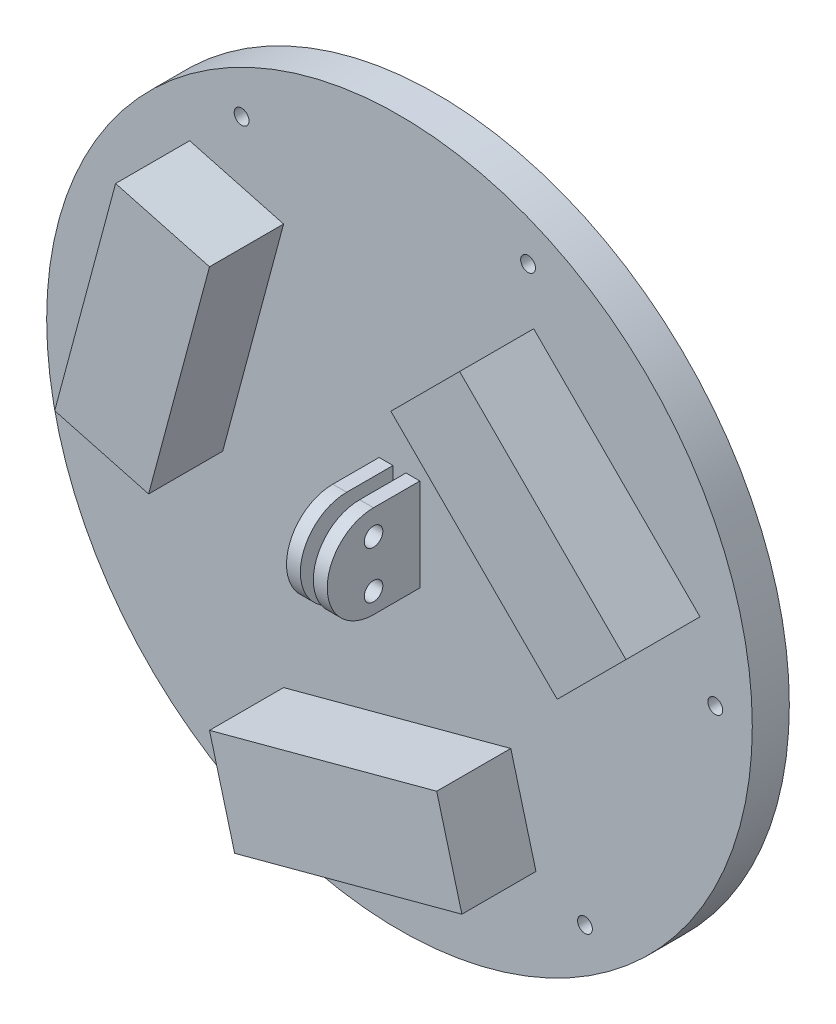
from build123d import *

# Parameters (mm, degrees)
SKETCH2_R           = 38.1
BOSS_EXTRUDE1_DEPTH = 4
SKETCH3_R           = 0.8
CUT_EXTRUDE1_DEPTH  = 6
SKETCH4_R           = 0.6
CUT_EXTRUDE2_DEPTH  = 6
SKETCH5_W           = 1.5
SKETCH5_H           = 10
BOSS_EXTRUDE2_DEPTH = 10
CUT_EXTRUDE3_DEPTH  = 58.198776211
SKETCH7_R           = 1
CUT_EXTRUDE4_DEPTH  = 58.198776211
BOSS_EXTRUDE3_DEPTH = 8
SKETCH10_R          = 0.8
CUT_EXTRUDE5_DEPTH  = 55.801642311


with BuildPart() as part:
    # Sketch2 → Boss-Extrude1 (new body)
    with BuildSketch(Plane.XY):
        Circle(SKETCH2_R)
    extrude(amount=BOSS_EXTRUDE1_DEPTH)

    # Sketch3 → Cut-Extrude1 (cut)
    with BuildSketch(Plane.XY.offset(4)):
        with Locations((34.1, -0.085721815)):
            Circle(SKETCH3_R)
        with Locations((-17.05, -29.617188084)):
            Circle(SKETCH3_R)
        with Locations((-17.05, 29.445744454)):
            Circle(SKETCH3_R)
    extrude(amount=-CUT_EXTRUDE1_DEPTH, mode=Mode.SUBTRACT)

    # Sketch4 → Cut-Extrude2 (cut)
    with BuildSketch(Plane.XY.offset(4)):
        Circle(SKETCH4_R)
    extrude(amount=-CUT_EXTRUDE2_DEPTH, mode=Mode.SUBTRACT)

    # Sketch5 → Boss-Extrude2 (add)
    with BuildSketch(Plane.XY.offset(4)):
        with Locations((1.45, 0)):
            Rectangle(SKETCH5_W, SKETCH5_H)
        with Locations((-1.45, 0)):
            Rectangle(SKETCH5_W, SKETCH5_H)
    extrude(amount=BOSS_EXTRUDE2_DEPTH)

    # Sketch6 → Cut-Extrude3 (cut, through all)
    with BuildSketch(Plane(origin=(2.2, 0, 0), x_dir=(0, 0, -1), z_dir=(1, 0, 0))):
        with BuildLine():
            ThreePointArc((-14, 0), (-12.535533906, 3.535533906), (-9, 5))
            Line((-9, 5), (-14, 5))
            Line((-14, 5), (-14, 0))
        make_face()
        with BuildLine():
            ThreePointArc((-9, -5), (-12.535533906, -3.535533906), (-14, 0))
            Line((-14, 0), (-14, -5))
            Line((-14, -5), (-9, -5))
        make_face()
    extrude(amount=-CUT_EXTRUDE3_DEPTH, mode=Mode.SUBTRACT)

    # Sketch7 → Cut-Extrude4 (cut, through all)
    with BuildSketch(Plane(origin=(2.2, 0, 0), x_dir=(0, 0, -1), z_dir=(1, 0, 0))):
        with Locations(Location((-9, 2.3, 0), (0, 0, 90))):
            Circle(SKETCH7_R)
        with Locations(Location((-9, -2.8, 0), (0, 0, 90))):
            Circle(SKETCH7_R)
    extrude(amount=-CUT_EXTRUDE4_DEPTH, mode=Mode.SUBTRACT)

    # Sketch8 → Boss-Extrude3 (add)
    with BuildSketch(Plane.XY.offset(4)):
        Polygon((25.028792455, 0), (32.453413657, 7.424621202), (14.492901415, 25.385133445), (7.068280213, 17.960512242), align=None)
        Polygon((12.02011976, -15.101566346), (14.737719734, -25.243787522), (-9.796796254, -31.817791268), (-12.514396227, -21.675570092), align=None)
        Polygon((-19.088399973, -2.858945896), (-29.230621149, -0.141345922), (-22.656617403, 24.393170065), (-12.514396227, 21.675570092), align=None)
    extrude(amount=BOSS_EXTRUDE3_DEPTH)

    # Sketch10 → Cut-Extrude5 (cut, through all)
    with BuildSketch(Plane.XY.offset(4)):
        with Locations((13.886765868, 31.144304997)):
            Circle(SKETCH10_R)
        with Locations((20.028376376, -27.598444517)):
            Circle(SKETCH10_R)
        with Locations((-33.915142244, -3.54586048)):
            Circle(SKETCH10_R)
    extrude(amount=-CUT_EXTRUDE5_DEPTH, mode=Mode.SUBTRACT)


solid = part.part
